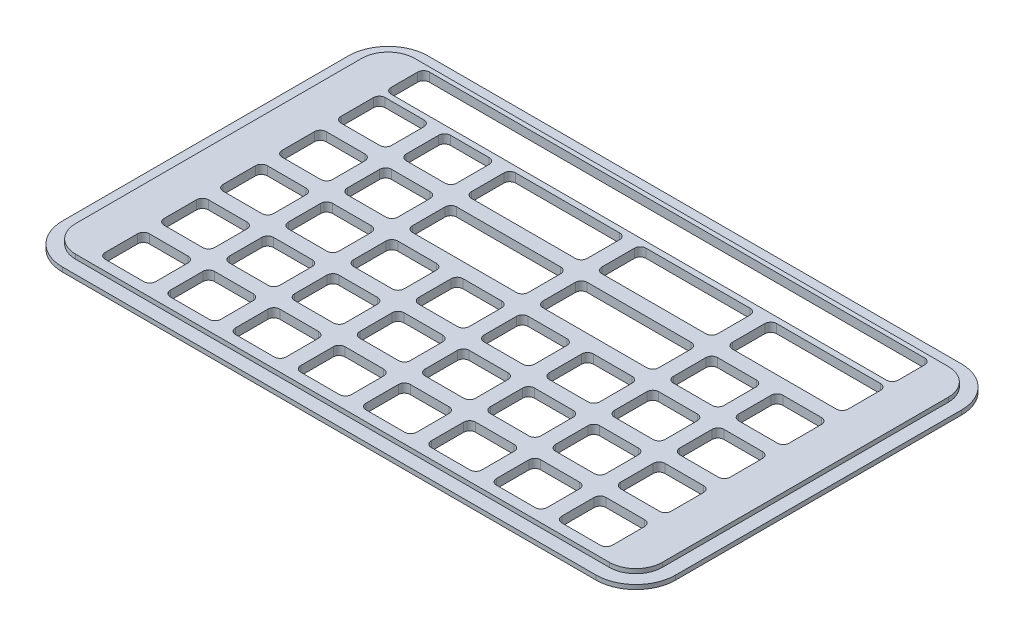
from build123d import *

# Parameters (mm, degrees)
SKETCH1_W           = 208
SKETCH1_H           = 124
OUTER_PROFILE_DEPTH = 1.5
SKETCH2_W           = 199
SKETCH2_H           = 115
INNER_PROFILE_DEPTH = 1.5
FILLET1_R           = 9
FILLET2_R           = 13.5
SKETCH4_W           = 172
SKETCH4_H           = 13
MESSAGE_BAR_DEPTH   = 122.115647214
SKETCH5_W           = 17.125
SKETCH5_H           = 15
CUTOUT_DEPTH        = 122.115647214
CUTOUTS_COUNT       = 8
CUTOUTS_PITCH       = 22.125
CUTOUTS_COUNT_DIR2  = 5
CUTOUTS_PITCH_DIR2  = 20
SKETCH6_W           = 5
SKETCH6_H           = 15
CUT_EXTRUDE3_DEPTH  = 122.115647214
RADS_R              = 2


with BuildPart() as part:
    # Sketch1 → Outer Profile (new body)
    with BuildSketch(Plane(origin=(0, 0, 0), x_dir=(1, 0, 0), z_dir=(0, 1, 0))):
        Rectangle(SKETCH1_W, SKETCH1_H)
    extrude(amount=OUTER_PROFILE_DEPTH)

    # Sketch2 → Inner Profile (add)
    with BuildSketch(Plane(origin=(0, 1.5, 0), x_dir=(1, 0, 0), z_dir=(0, 1, 0))):
        Rectangle(SKETCH2_W, SKETCH2_H)
    extrude(amount=INNER_PROFILE_DEPTH)

    # Fillet1
    fillet1_edges = [part.edges().sort_by_distance(p)[0] for p in [
        (99.5, 2.25, 57.5),
        (99.5, 2.25, -57.5),
        (-99.5, 2.25, -57.5),
        (-99.5, 2.25, 57.5),
    ]]
    fillet(fillet1_edges, radius=FILLET1_R)

    # Fillet2
    fillet2_edges = [part.edges().sort_by_distance(p)[0] for p in [
        (104, 0.75, 62),
        (-104, 0.75, 62),
        (-104, 0.75, -62),
        (104, 0.75, -62),
    ]]
    fillet(fillet2_edges, radius=FILLET2_R)

    # Sketch4 → Message Bar (cut, through all)
    with BuildSketch(Plane(origin=(0, 3, 0), x_dir=(1, 0, 0), z_dir=(0, 1, 0))):
        with Locations((0, 49.5)):
            Rectangle(SKETCH4_W, SKETCH4_H)
    extrude(amount=-MESSAGE_BAR_DEPTH, mode=Mode.SUBTRACT)

    # Sketch5 → Cutout (cut, through all)
    with BuildSketch(Plane(origin=(0, 3, 0), x_dir=(1, 0, 0), z_dir=(0, 1, 0))):
        with Locations((-77.4375, -46.5)):
            Rectangle(SKETCH5_W, SKETCH5_H)
    cutout = extrude(amount=-CUTOUT_DEPTH, mode=Mode.SUBTRACT)

    # Cutouts: Cutout 8 × 5
    with Locations(*[(i * CUTOUTS_PITCH, 0, -j * CUTOUTS_PITCH_DIR2) for i in range(CUTOUTS_COUNT) for j in range(CUTOUTS_COUNT_DIR2) if (i, j) != (0, 0)]):
        add(cutout, mode=Mode.SUBTRACT)

    # Sketch6 → Cut-Extrude3 (cut, through all)
    with BuildSketch(Plane(origin=(0, 3, 0), x_dir=(1, 0, 0), z_dir=(0, 1, 0))):
        with Locations((-22.125, 33.5)):
            Rectangle(SKETCH6_W, SKETCH6_H)
        with Locations((22.125, 33.5)):
            Rectangle(SKETCH6_W, SKETCH6_H)
        with Locations((66.375, 33.5)):
            Rectangle(SKETCH6_W, SKETCH6_H)
        with Locations((-22.125, 13.5)):
            Rectangle(SKETCH6_W, SKETCH6_H)
        with Locations((22.125, 13.5)):
            Rectangle(SKETCH6_W, SKETCH6_H)
    extrude(amount=-CUT_EXTRUDE3_DEPTH, mode=Mode.SUBTRACT)

    # Rads
    rads_edges = [part.edges().sort_by_distance(p)[0] for p in [
        (-68.875, 1.5, 54),
        (-86, 1.5, 34),
        (-86, 1.5, 19),
        (-68.875, 1.5, 19),
        (-68.875, 1.5, 34),
        (-86, 1.5, 14),
        (-86, 1.5, -1),
        (-68.875, 1.5, -1),
        (-68.875, 1.5, 14),
        (-86, 1.5, -6),
        (-86, 1.5, -21),
        (-68.875, 1.5, -21),
        (-68.875, 1.5, -6),
        (-86, 1.5, -26),
        (-86, 1.5, -41),
        (-68.875, 1.5, -41),
        (-68.875, 1.5, -26),
        (-63.875, 1.5, 54),
        (-63.875, 1.5, 39),
        (-46.75, 1.5, 39),
        (-46.75, 1.5, 54),
        (-63.875, 1.5, 34),
        (-63.875, 1.5, 19),
        (-46.75, 1.5, 19),
        (-46.75, 1.5, 34),
        (-63.875, 1.5, 14),
        (-63.875, 1.5, -1),
        (-46.75, 1.5, -1),
        (-46.75, 1.5, 14),
        (-63.875, 1.5, -6),
        (-63.875, 1.5, -21),
        (-46.75, 1.5, -21),
        (-46.75, 1.5, -6),
        (-63.875, 1.5, -26),
        (-63.875, 1.5, -41),
        (-46.75, 1.5, -41),
        (-46.75, 1.5, -26),
        (-41.75, 1.5, 54),
        (-41.75, 1.5, 39),
        (-24.625, 1.5, 39),
        (-24.625, 1.5, 54),
        (-41.75, 1.5, 34),
        (-41.75, 1.5, 19),
        (-24.625, 1.5, 19),
        (-24.625, 1.5, 34),
        (-41.75, 1.5, 14),
        (-41.75, 1.5, -1),
        (-24.625, 1.5, -1),
        (-24.625, 1.5, 14),
        (-41.75, 1.5, -6),
        (-41.75, 1.5, -21),
        (-41.75, 1.5, -26),
        (-41.75, 1.5, -41),
        (-19.625, 1.5, 54),
        (-19.625, 1.5, 39),
        (-2.5, 1.5, 39),
        (-2.5, 1.5, 54),
        (-19.625, 1.5, 34),
        (-19.625, 1.5, 19),
        (-2.5, 1.5, 19),
        (-2.5, 1.5, 34),
        (-19.625, 1.5, 14),
        (-19.625, 1.5, -1),
        (-2.5, 1.5, -1),
        (-2.5, 1.5, 14),
        (-2.5, 1.5, -21),
        (-2.5, 1.5, -6),
        (-2.5, 1.5, -41),
        (-2.5, 1.5, -26),
        (2.5, 1.5, 54),
        (2.5, 1.5, 39),
        (19.625, 1.5, 39),
        (19.625, 1.5, 54),
        (2.5, 1.5, 34),
        (2.5, 1.5, 19),
        (19.625, 1.5, 19),
        (19.625, 1.5, 34),
        (2.5, 1.5, 14),
        (2.5, 1.5, -1),
        (19.625, 1.5, -1),
        (19.625, 1.5, 14),
        (2.5, 1.5, -6),
        (2.5, 1.5, -21),
        (2.5, 1.5, -26),
        (2.5, 1.5, -41),
        (24.625, 1.5, 54),
        (24.625, 1.5, 39),
        (41.75, 1.5, 39),
        (41.75, 1.5, 54),
        (24.625, 1.5, 34),
        (24.625, 1.5, 19),
        (41.75, 1.5, 19),
        (41.75, 1.5, 34),
        (24.625, 1.5, 14),
        (24.625, 1.5, -1),
        (41.75, 1.5, -1),
        (41.75, 1.5, 14),
        (41.75, 1.5, -21),
        (41.75, 1.5, -6),
        (41.75, 1.5, -41),
        (41.75, 1.5, -26),
        (46.75, 1.5, 54),
        (46.75, 1.5, 39),
        (63.875, 1.5, 39),
        (63.875, 1.5, 54),
        (46.75, 1.5, 34),
        (46.75, 1.5, 19),
        (63.875, 1.5, 19),
        (63.875, 1.5, 34),
        (46.75, 1.5, 14),
        (46.75, 1.5, -1),
        (63.875, 1.5, -1),
        (63.875, 1.5, 14),
        (46.75, 1.5, -6),
        (46.75, 1.5, -21),
        (63.875, 1.5, -21),
        (63.875, 1.5, -6),
        (46.75, 1.5, -26),
        (46.75, 1.5, -41),
        (68.875, 1.5, 54),
        (68.875, 1.5, 39),
        (86, 1.5, 39),
        (86, 1.5, 54),
        (68.875, 1.5, 34),
        (68.875, 1.5, 19),
        (86, 1.5, 19),
        (86, 1.5, 34),
        (68.875, 1.5, 14),
        (68.875, 1.5, -1),
        (86, 1.5, -1),
        (86, 1.5, 14),
        (68.875, 1.5, -6),
        (68.875, 1.5, -21),
        (86, 1.5, -21),
        (86, 1.5, -6),
        (86, 1.5, -41),
        (86, 1.5, -26),
        (-86, 1.5, -43),
        (-86, 1.5, -56),
        (86, 1.5, -56),
        (86, 1.5, -43),
        (-86, 1.5, 54),
        (-86, 1.5, 39),
        (-68.875, 1.5, 39),
    ]]
    fillet(rads_edges, radius=RADS_R)


solid = part.part
